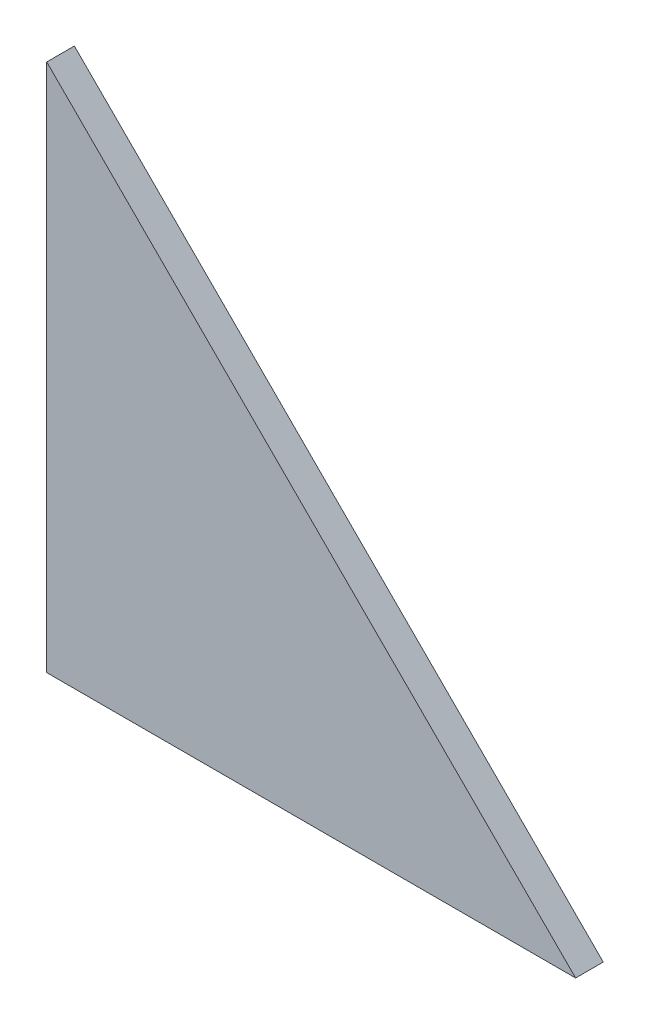
from build123d import *

# Parameters (mm, degrees)
BOSS_EXTRU_1_DEPTH = 20


with BuildPart() as part:
    # Esquisse1 → Boss.-Extru.1 (new body)
    with BuildSketch(Plane.XY):
        Polygon((0, 0), (0, 383), (383, 0), align=None)
    extrude(amount=BOSS_EXTRU_1_DEPTH)


solid = part.part
